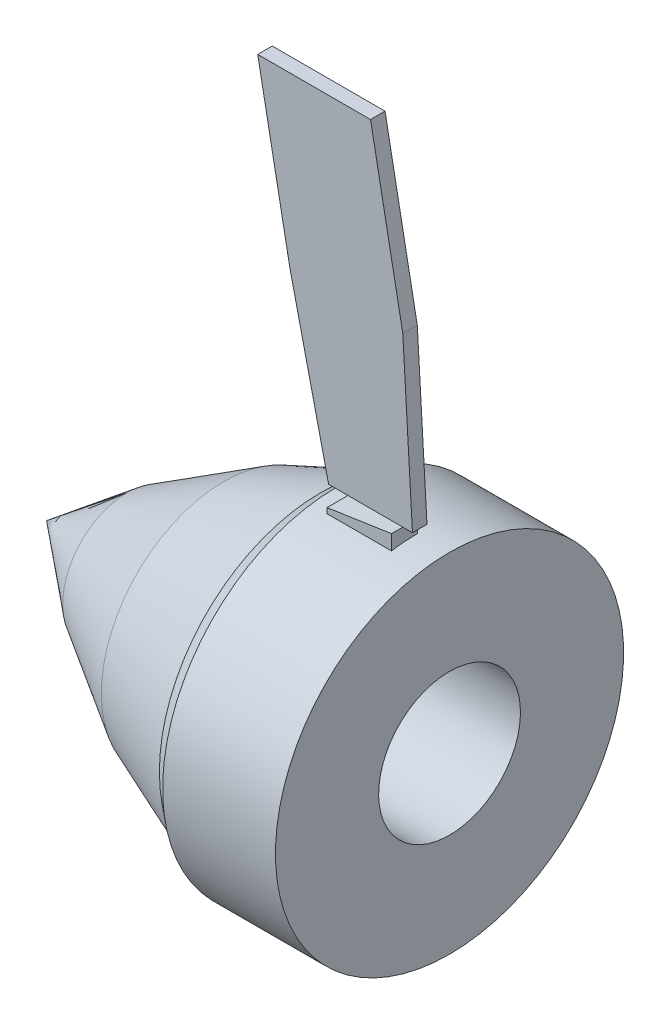
from build123d import *

# Parameters (mm, degrees)
REVOLVE1_ANGLE      = 359.999999589
SKETCH2_W           = 350
SKETCH2_H           = 320
REVOLVE2_ANGLE      = 359.999999589
BOSS_EXTRUDE1_DEPTH = 80
BOSS_EXTRUDE2_DEPTH = 45


with BuildPart() as part:
    # Sketch1 → Revolve1 (revolve)
    with BuildSketch(Plane.XY):
        Polygon((0, 0), (250, 200), (550, 380), (850, 500), (900, 540), (920, 540), (920, 460), (850, 460), (550, 350), (250, 170), (50, 0), align=None)
    revolve(axis=Axis((0, 0, 0), (1, 0, 0)), revolution_arc=REVOLVE1_ANGLE)


with BuildPart() as body_2:
    # Sketch2 → Revolve2 (revolve)
    with BuildSketch(Plane.XY):
        with Locations((1075, 380)):
            Rectangle(SKETCH2_W, SKETCH2_H)
    revolve(axis=Axis((0, 0, 0), (1, 0, 0)), revolution_arc=REVOLVE2_ANGLE)


with BuildPart() as body_3:
    # Sketch3 → Boss-Extrude1 (new body)
    with BuildSketch(Plane.XY):
        Polygon((950, 500), (950, 550), (1150, 580), (1150, 500), align=None)
    extrude(amount=BOSS_EXTRUDE1_DEPTH)


with BuildPart() as body_4:
    # Sketch4 → Boss-Extrude2 (new body)
    with BuildSketch(Plane.XY):
        Polygon((920, 580), (800, 1100), (700, 1625), (1050, 1625), (1150, 1100), (1180, 580), align=None)
    extrude(amount=BOSS_EXTRUDE2_DEPTH)


solid = Compound([part.part, body_2.part, body_3.part, body_4.part])
